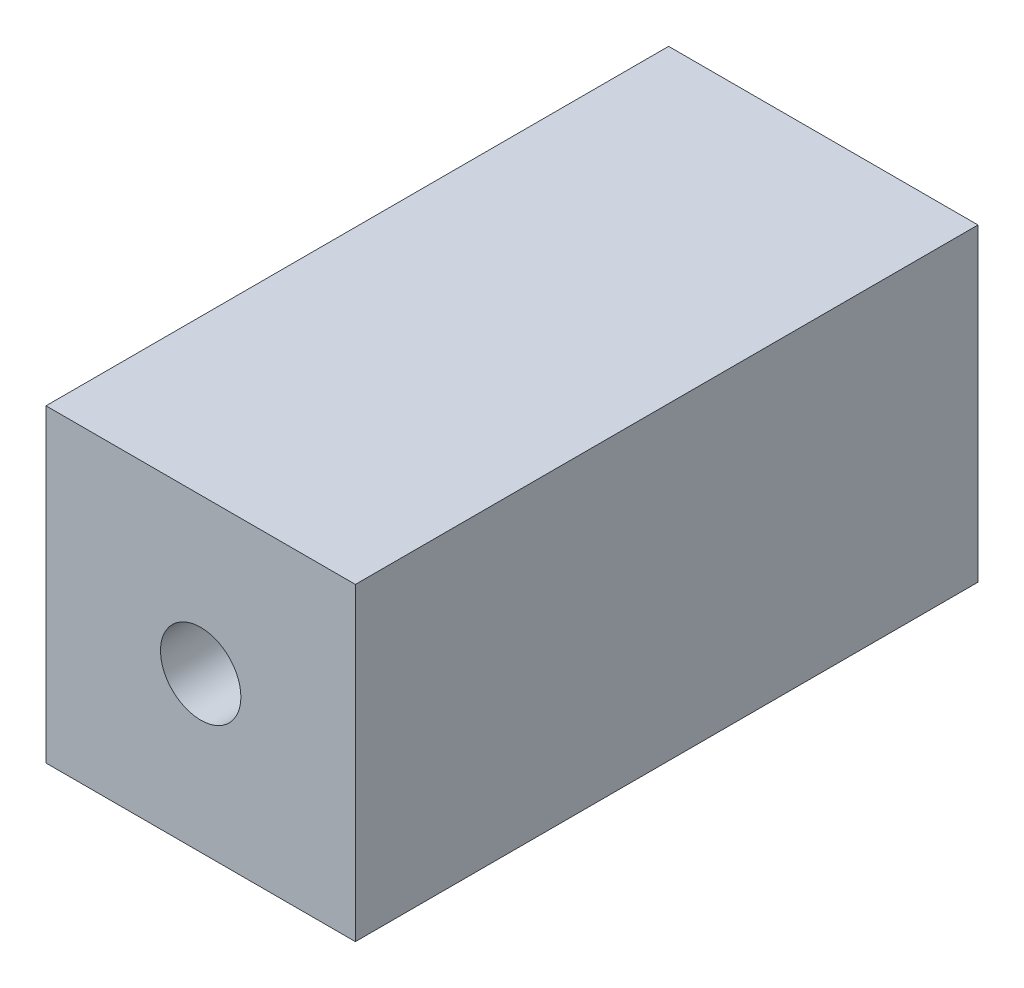
from build123d import *

# Parameters (mm, degrees)
SKETCH1_W           = 25.4
SKETCH1_H           = 25.4
BOSS_EXTRUDE1_DEPTH = 25.557792928
SKETCH2_R           = 3.300000004
CUT_EXTRUDE1_DEPTH  = 55.179176049


with BuildPart() as part:
    # Sketch1 → Boss-Extrude1 (new, symmetric)
    with BuildSketch(Plane.XY):
        Rectangle(SKETCH1_W, SKETCH1_H)
    extrude(amount=BOSS_EXTRUDE1_DEPTH, both=True)

    # Sketch2 → Cut-Extrude1 (cut, through all)
    with BuildSketch(Plane.XY.offset(25.557792928)):
        Circle(SKETCH2_R)
    extrude(amount=-CUT_EXTRUDE1_DEPTH, mode=Mode.SUBTRACT)


solid = part.part
